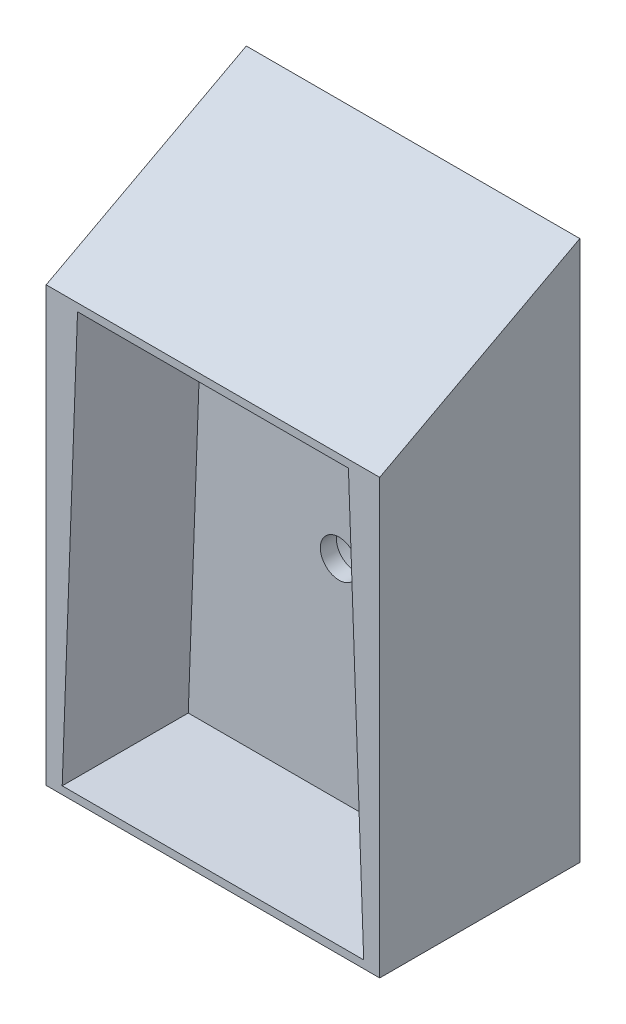
from build123d import *

# Parameters (mm, degrees)
SKICA1_W                 = 50
SKICA1_H                 = 65
P_IDAT_VYSUNUT_M1_DEPTH  = 30
P_IDAT_VYSUNUT_M2_DEPTH  = 50
ODEBRAT_VYSUNUT_M1_DEPTH = 18.9
SKICA6_R                 = 2.8
ODEBRAT_VYSUNUT_M2_DEPTH = 58.744783314
SKICA7_R                 = 7.5
ODEBRAT_VYSUNUT_M3_DEPTH = 8.7
SKICA8_R                 = 2.35
ODEBRAT_VYSUNUT_M4_DEPTH = 8.5


with BuildPart() as part:
    # Skica1 → Přidat vysunutím1 (new body)
    with BuildSketch(Plane.XY):
        Rectangle(SKICA1_W, SKICA1_H)
    extrude(amount=P_IDAT_VYSUNUT_M1_DEPTH)

    # Skica3 → Přidat vysunutím2 (add, through all)
    with BuildSketch(Plane(origin=(25, 0, 0), x_dir=(0, 0, -1), z_dir=(1, 0, 0))):
        Polygon((0, 32.5), (0, 48.5), (-30, 32.5), align=None)
    extrude(amount=-P_IDAT_VYSUNUT_M2_DEPTH)

    # Skica5 → Odebrat vysunutím1 (cut)
    with BuildSketch(Plane.XY.offset(30)):
        Polygon((-20.3, 31.35), (20.31, 31.35), (22.6, -31.35), (-22.6, -31.35), align=None)
    extrude(amount=-ODEBRAT_VYSUNUT_M1_DEPTH, mode=Mode.SUBTRACT)

    # Skica6 → Odebrat vysunutím2 (cut, through all)
    with BuildSketch(Plane.XY.offset(11.1)):
        Circle(SKICA6_R)
    extrude(amount=-ODEBRAT_VYSUNUT_M2_DEPTH, mode=Mode.SUBTRACT)

    # Skica7 → Odebrat vysunutím3 (cut)
    with BuildSketch(Plane(origin=(0, 0, 0), x_dir=(-1, 0, 0), z_dir=(0, 0, -1))):
        Circle(SKICA7_R)
    extrude(amount=-ODEBRAT_VYSUNUT_M3_DEPTH, mode=Mode.SUBTRACT)

    # Skica8 → Odebrat vysunutím4 (cut)
    with BuildSketch(Plane(origin=(0, 0, 0), x_dir=(-1, 0, 0), z_dir=(0, 0, -1))):
        with Locations((7.14901322, 26.607213292)):
            Circle(SKICA8_R)
        with Locations(Location((-7.14901322, 26.607213292, 0), (0, 0, 180))):
            Circle(SKICA8_R)
        with Locations(Location((7.14901322, 37.192786708, 0), (0, 0, 180))):
            Circle(SKICA8_R)
        with Locations((-7.14901322, 37.192786708)):
            Circle(SKICA8_R)
    extrude(amount=-ODEBRAT_VYSUNUT_M4_DEPTH, mode=Mode.SUBTRACT)


solid = part.part
